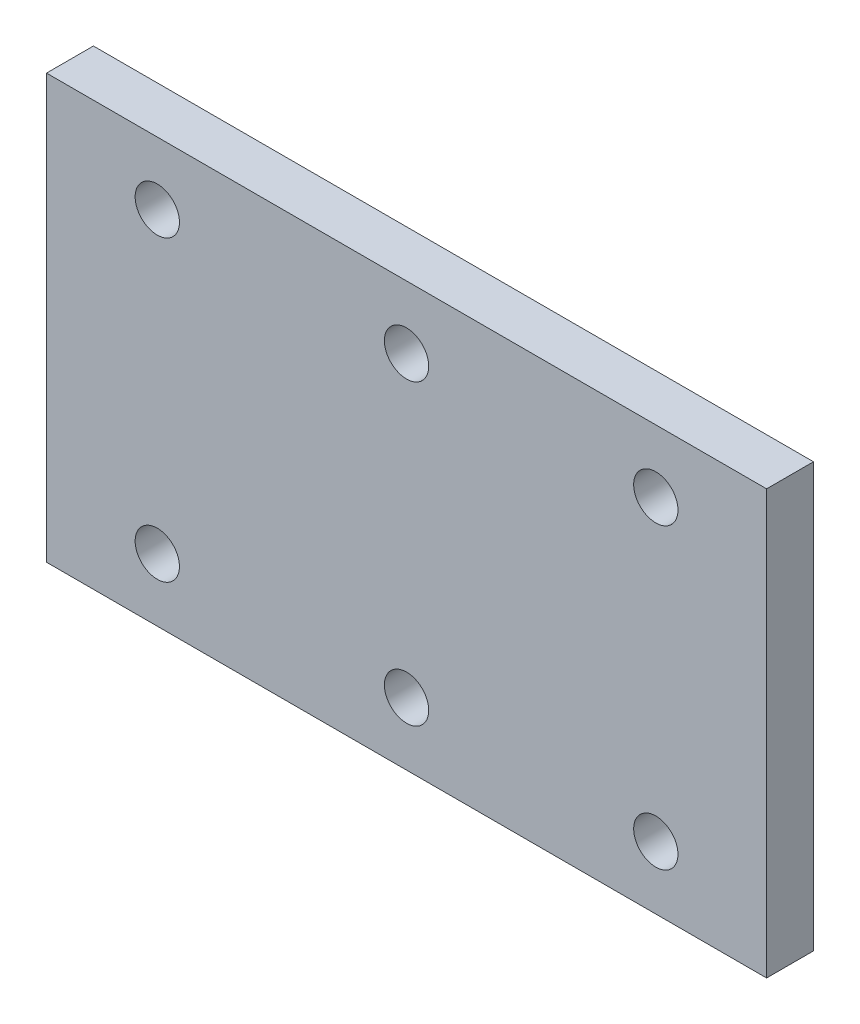
from build123d import *

# Parameters (mm, degrees)
SKETCH1_W           = 97.5
SKETCH1_H           = 57.36
BOSS_EXTRUDE1_DEPTH = 6.35
SKETCH2_R           = 3
CUT_EXTRUDE1_DEPTH  = 57.915967882


with BuildPart() as part:
    # Sketch1 → Boss-Extrude1 (new body)
    with BuildSketch(Plane.XY):
        Rectangle(SKETCH1_W, SKETCH1_H)
    extrude(amount=BOSS_EXTRUDE1_DEPTH)

    # Sketch2 → Cut-Extrude1 (cut, through all)
    with BuildSketch(Plane.XY.offset(6.35)):
        with Locations((-33.75, 20.18)):
            Circle(SKETCH2_R)
        with Locations((0, 20.18)):
            Circle(SKETCH2_R)
        with Locations((33.75, 20.18)):
            Circle(SKETCH2_R)
        with Locations(Location((33.75, -20.18, 0), (0, 0, 180))):
            Circle(SKETCH2_R)
        with Locations(Location((0, -20.18, 0), (0, 0, 180))):
            Circle(SKETCH2_R)
        with Locations(Location((-33.75, -20.18, 0), (0, 0, 180))):
            Circle(SKETCH2_R)
    extrude(amount=-CUT_EXTRUDE1_DEPTH, mode=Mode.SUBTRACT)


solid = part.part
